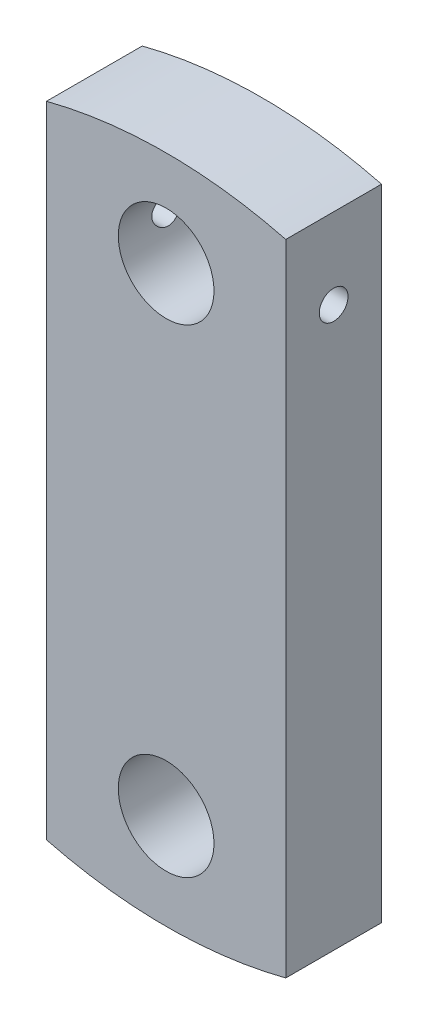
from build123d import *

# Parameters (mm, degrees)
SKETCH1_R             = 5
CORPO_DEPTH           = 10
SKETCH2_R             = 1.5
FURO_3_PASSANTE_DEPTH = 45.158804332


with BuildPart() as part:
    # Sketch1 → Corpo (new body)
    with BuildSketch(Plane.XY):
        with BuildLine():
            Line((-12.5, -33.412291828), (-12.5, 33.412291828))
            ThreePointArc((-12.5, 33.412291828), (0, 35), (12.5, 33.412291828))
            Line((12.5, 33.412291828), (12.5, -33.412291828))
            ThreePointArc((12.5, -33.412291828), (0, -35), (-12.5, -33.412291828))
        make_face()
        with Locations((0, -25)):
            Circle(SKETCH1_R, mode=Mode.SUBTRACT)
        with Locations((0, 25)):
            Circle(SKETCH1_R, mode=Mode.SUBTRACT)
    extrude(amount=CORPO_DEPTH)

    # Sketch2 → Furo Ø3 Passante (cut, through all)
    with BuildSketch(Plane(origin=(12.5, 0, 0), x_dir=(0, 0, -1), z_dir=(1, 0, 0))):
        with Locations(Location((-5, 25, 0), (0, 0, 90))):
            Circle(SKETCH2_R)
    extrude(amount=-FURO_3_PASSANTE_DEPTH, mode=Mode.SUBTRACT)


solid = part.part
